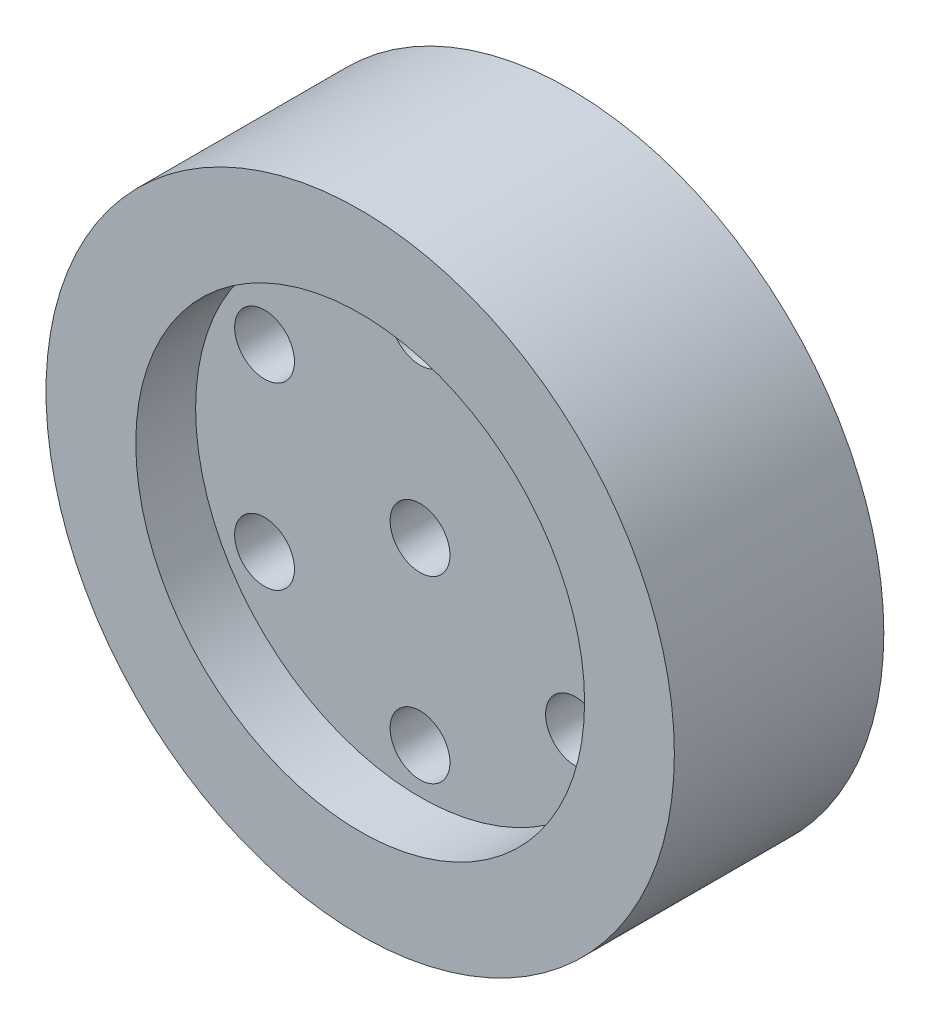
from build123d import *

# Parameters (mm, degrees)
SKETCH1_R           = 21
BOSS_EXTRUDE1_DEPTH = 7
SKETCH2_R           = 15
CUT_EXTRUDE1_DEPTH  = 4
SKETCH3_R           = 2
CUT_EXTRUDE2_DEPTH  = 32.336879232
SKETCH4_R           = 19
CUT_EXTRUDE3_DEPTH  = 4
SKETCH7_R           = 5
BOSS_EXTRUDE3_DEPTH = 4
SKETCH8_R           = 2
CUT_EXTRUDE5_DEPTH  = 33.832910319


with BuildPart() as part:
    # Sketch1 → Boss-Extrude1 (new, symmetric)
    with BuildSketch(Plane.XY):
        Circle(SKETCH1_R)
    extrude(amount=BOSS_EXTRUDE1_DEPTH, both=True)

    # Sketch2 → Cut-Extrude1 (cut)
    with BuildSketch(Plane.XY.offset(7)):
        Circle(SKETCH2_R)
    extrude(amount=-CUT_EXTRUDE1_DEPTH, mode=Mode.SUBTRACT)

    # Sketch3 → Cut-Extrude2 (cut, through all)
    with BuildSketch(Plane.XY.offset(3)):
        with Locations((0, 12)):
            Circle(SKETCH3_R)
        with Locations((10.392304845, 6)):
            Circle(SKETCH3_R)
        with Locations((10.392304845, -6)):
            Circle(SKETCH3_R)
        with Locations((0, -12)):
            Circle(SKETCH3_R)
        with Locations((-10.392304845, -6)):
            Circle(SKETCH3_R)
        with Locations((-10.392304845, 6)):
            Circle(SKETCH3_R)
    extrude(amount=-CUT_EXTRUDE2_DEPTH, mode=Mode.SUBTRACT)

    # Sketch4 → Cut-Extrude3 (cut)
    with BuildSketch(Plane(origin=(0, 0, -7), x_dir=(-1, 0, 0), z_dir=(0, 0, -1))):
        Circle(SKETCH4_R)
    extrude(amount=-CUT_EXTRUDE3_DEPTH, mode=Mode.SUBTRACT)

    # Sketch7 → Boss-Extrude3 (add)
    with BuildSketch(Plane(origin=(0, 0, -3), x_dir=(-1, 0, 0), z_dir=(0, 0, -1))):
        with Locations(Location((0, 0, 0), (0, 0, 180))):
            Circle(SKETCH7_R)
    extrude(amount=BOSS_EXTRUDE3_DEPTH)

    # Sketch8 → Cut-Extrude5 (cut, through all)
    with BuildSketch(Plane(origin=(0, 0, -7), x_dir=(-1, 0, 0), z_dir=(0, 0, -1))):
        Circle(SKETCH8_R)
    extrude(amount=-CUT_EXTRUDE5_DEPTH, mode=Mode.SUBTRACT)


solid = part.part
